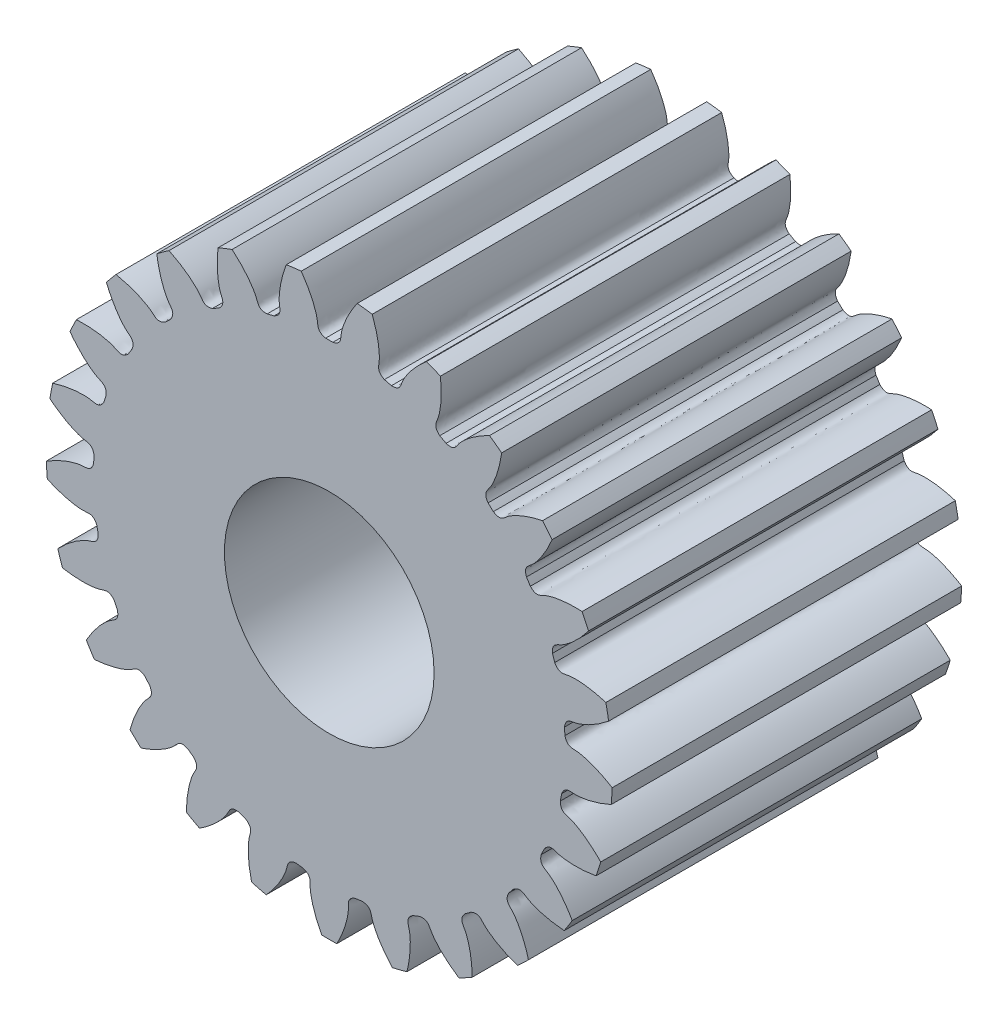
from build123d import *

# Parameters (mm, degrees)
SKETCH_1_R               = 4.05
EXTRUDE_1_DEPTH          = 5
CUT_EXTRUDE_1_DEPTH      = 8.60295995
PATTERN_CIRCULAR_1_COUNT = 25
SKETCH_4_R               = 1.5
CUT_EXTRUDE_3_DEPTH      = 8.601546017


with BuildPart() as part:
    # 草图1 → 凸台-拉伸1 (new body)
    with BuildSketch(Plane.XY):
        Circle(SKETCH_1_R)
    extrude(amount=EXTRUDE_1_DEPTH)

    # 草图2 → 切除-拉伸1 (cut, through all)
    with BuildSketch(Plane.XY):
        with BuildLine():
            ThreePointArc((0.051617546, 3.374605255), (0, 3.375), (-0.051617546, 3.374605255))
            add(Edge.make_bspline(
                [(-0.051617546, 3.374605255), (-0.172001944, 3.400524349), (-0.160652291, 3.473178418), (-0.172258616, 3.545415827), (-0.173886381, 3.554432533), (-0.175972929, 3.564796657), (-0.178570656, 3.576493335), (-0.181734235, 3.589505574), (-0.185516979, 3.603814919), (-0.189971954, 3.61940125), (-0.195151573, 3.636242865), (-0.201107668, 3.654316475), (-0.207891407, 3.673597224), (-0.215553268, 3.694058705), (-0.224142993, 3.715672981), (-0.233709548, 3.7384106), (-0.244301079, 3.762240616), (-0.255964879, 3.787130613), (-0.268747339, 3.813046725), (-0.282693918, 3.839953657), (-0.2978491, 3.867814713), (-0.314256357, 3.89659182), (-0.331958109, 3.926245552), (-0.350995695, 3.956735159), (-0.371409328, 3.988018595), (-0.393238066, 4.020052543), (-0.416519776, 4.052792452), (-0.441291098, 4.086192558), (-0.467587416, 4.120205925), (-0.495442821, 4.15478447), (-0.524890083, 4.189879), (-0.555960621, 4.225439243), (-0.588684469, 4.261413885), (-0.623090249, 4.297750606), (-0.659205147, 4.334396112), (-0.697054878, 4.371296175), (-0.736663666, 4.408395671), (-0.778054218, 4.445638616), (-0.821247686, 4.482968208), (-0.881992183, 4.533379882), (-0.929239965, 4.570227946), (-0.961581443, 4.594450251)],
                knots=[0, 0, 0, 0, 0.130741207, 0.13574479, 0.141658115, 0.148481183, 0.156213993, 0.164856545, 0.174408839, 0.184870876, 0.196242655, 0.208524177, 0.221715441, 0.235816447, 0.250827195, 0.266747686, 0.283577919, 0.301317894, 0.319967612, 0.339527072, 0.359996274, 0.381375219, 0.403663906, 0.426862335, 0.450970507, 0.475988421, 0.501916077, 0.528753476, 0.556500617, 0.5851575, 0.614724126, 0.645200493, 0.676586604, 0.708882456, 0.742088051, 0.776203388, 0.811228468, 0.847163289, 0.884007854, 0.92176216, 1, 1, 1, 1], degree=3))
            ThreePointArc((-0.961581443, 4.594450251), (0, 4.693997442), (0.961581443, 4.594450251))
            add(Edge.make_bspline(
                [(0.051617546, 3.374605255), (0.172001944, 3.400524349), (0.160652291, 3.473178418), (0.172258616, 3.545415827), (0.173886381, 3.554432533), (0.175972929, 3.564796657), (0.178570656, 3.576493335), (0.181734235, 3.589505574), (0.185516979, 3.603814919), (0.189971954, 3.61940125), (0.195151573, 3.636242865), (0.201107668, 3.654316475), (0.207891407, 3.673597224), (0.215553268, 3.694058705), (0.224142993, 3.715672981), (0.233709548, 3.7384106), (0.244301079, 3.762240616), (0.255964879, 3.787130613), (0.268747339, 3.813046725), (0.282693918, 3.839953657), (0.2978491, 3.867814713), (0.314256357, 3.89659182), (0.331958109, 3.926245552), (0.350995695, 3.956735159), (0.371409328, 3.988018595), (0.393238066, 4.020052543), (0.416519776, 4.052792452), (0.441291098, 4.086192558), (0.467587416, 4.120205925), (0.495442821, 4.15478447), (0.524890083, 4.189879), (0.555960621, 4.225439243), (0.588684469, 4.261413885), (0.623090249, 4.297750606), (0.659205147, 4.334396112), (0.697054878, 4.371296175), (0.736663666, 4.408395671), (0.778054218, 4.445638616), (0.821247686, 4.482968208), (0.881992183, 4.533379882), (0.929239965, 4.570227946), (0.961581443, 4.594450251)],
                knots=[0, 0, 0, 0, 0.130741207, 0.13574479, 0.141658115, 0.148481183, 0.156213993, 0.164856545, 0.174408839, 0.184870876, 0.196242655, 0.208524177, 0.221715441, 0.235816447, 0.250827195, 0.266747686, 0.283577919, 0.301317894, 0.319967612, 0.339527072, 0.359996274, 0.381375219, 0.403663906, 0.426862335, 0.450970507, 0.475988421, 0.501916077, 0.528753476, 0.556500617, 0.5851575, 0.614724126, 0.645200493, 0.676586604, 0.708882456, 0.742088051, 0.776203388, 0.811228468, 0.847163289, 0.884007854, 0.92176216, 1, 1, 1, 1], degree=3))
        make_face()
    cut_extrude_1 = extrude(amount=CUT_EXTRUDE_1_DEPTH, mode=Mode.SUBTRACT)

    # 阵列(圆周)1: 切除-拉伸1 ×25 about axis
    pattern_circular_1_axis = Axis((0, 0, 5), (0, 0, -1))
    for i in range(1, PATTERN_CIRCULAR_1_COUNT):
        add(cut_extrude_1.rotate(pattern_circular_1_axis, i * 360 / PATTERN_CIRCULAR_1_COUNT), mode=Mode.SUBTRACT)

    # 草图4 → 切除-拉伸3 (cut, through all)
    with BuildSketch(Plane.XY):
        Circle(SKETCH_4_R)
    extrude(amount=CUT_EXTRUDE_3_DEPTH, mode=Mode.SUBTRACT)


solid = part.part
